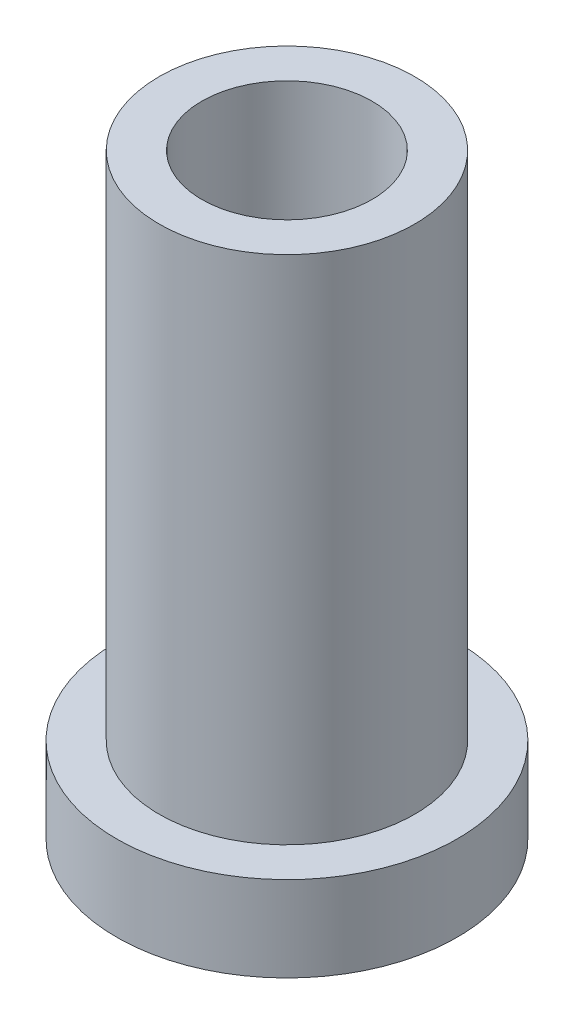
from build123d import *

# Parameters (mm, degrees)
SKETCH2_R          = 5
CUT_EXTRUDE1_DEPTH = 38.749172176


with BuildPart() as part:
    # Sketch1 → Revolve1 (revolve)
    with BuildSketch(Plane.XY, mode=Mode.PRIVATE) as revolve1_sk:
        Polygon((0, 0), (10, 0), (10, 5), (7.5, 5), (7.5, 35), (0, 35), align=None)
    revolve(revolve1_sk.sketch.rotate(Axis((0, 40, 0), (0, -1, 0)), 180), axis=Axis((0, 40, 0), (0, -1, 0)))

    # Sketch2 → Cut-Extrude1 (cut, through all)
    with BuildSketch(Plane(origin=(0, 35, 0), x_dir=(1, 0, 0), z_dir=(0, 1, 0))):
        with Locations(Location((0, 0, 0), (0, 0, 180))):
            Circle(SKETCH2_R)
    extrude(amount=-CUT_EXTRUDE1_DEPTH, mode=Mode.SUBTRACT)


solid = part.part
